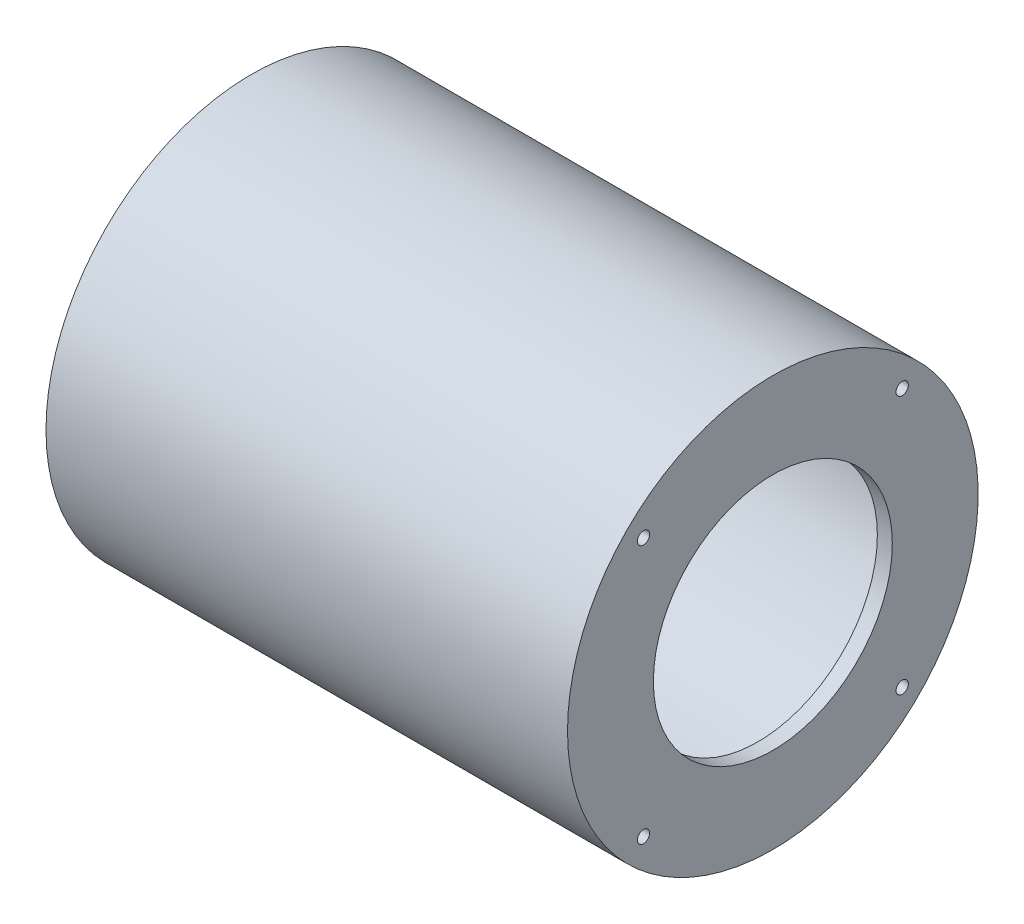
from build123d import *

# Parameters (mm, degrees)
AXIAL_START       = 9.7
SKETCH2_R         = 1.65
AXIAL_HOLES_DEPTH = 4


with BuildPart() as part:
    # Axial profile (mm) → Full revolution (revolve)
    with BuildSketch(Plane.XY, mode=Mode.PRIVATE) as full_revolution_sk:
        Polygon((-126, 52), (9.7, 52), (9.7, 32), (13.7, 32), (13.7, 55), (-126, 55), align=None)
    revolve(full_revolution_sk.sketch.rotate(Axis((-110, 0, 0), (1, 0, 0)), 90), axis=Axis((-110, 0, 0), (1, 0, 0)))

    # Sketch2 → Axial holes (cut)
    with BuildSketch(Plane(origin=(0, 0, 0), x_dir=(0, 0, -1), z_dir=(1, 0, 0)).offset(AXIAL_START)):
        with Locations((-34.648232278, 34.648232278)):
            Circle(SKETCH2_R)
        with Locations((-34.648232278, -34.648232278)):
            Circle(SKETCH2_R)
        with Locations((34.648232278, -34.648232278)):
            Circle(SKETCH2_R)
        with Locations((34.648232278, 34.648232278)):
            Circle(SKETCH2_R)
    extrude(amount=AXIAL_HOLES_DEPTH, mode=Mode.SUBTRACT)


solid = part.part
